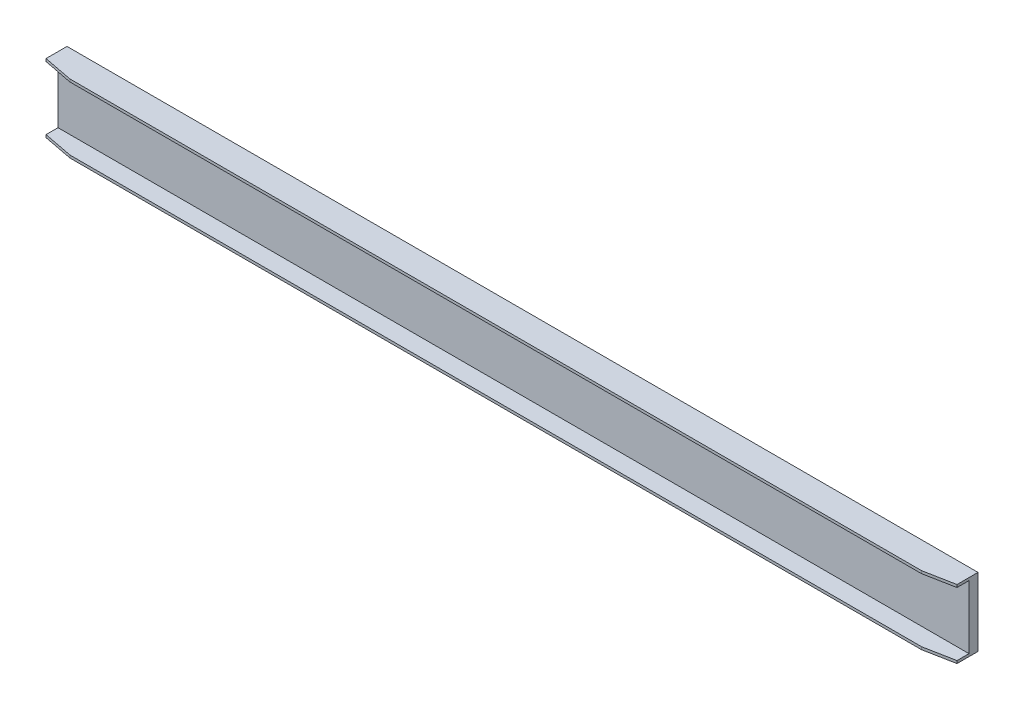
from build123d import *

# Parameters (mm, degrees)
SKETCH_1_W          = 3990
SKETCH_1_H          = 300
SKETCH_1_R          = 13
SKETCH_1_R_2        = 11.5
EXTRUDE_1608_DEPTH  = 39.5
SKETCH_2_W          = 3990
SKETCH_2_H          = 11.5
EXTRUDE_1_DEPTH     = 77.5
SKETCH_3_W          = 70
SKETCH_3_H          = 230
EXTRUDE_2_DEPTH     = 16
SKETCH_4_R          = 13
CUT_EXTRUDE_1_DEPTH = 2003.131676489
CUT_EXTRUDE_2_DEPTH = 2021.820130541
SKETCH_6_W          = 3990
SKETCH_6_H          = 277
EXTRUDE_3_DEPTH     = 39.5
SKETCH_7_W          = 70
SKETCH_7_H          = 230
EXTRUDE_4_DEPTH     = 16


with BuildPart() as part:
    # 草图1 → Extrude 1608 (new body)
    with BuildSketch(Plane.XY):
        Rectangle(SKETCH_1_W, SKETCH_1_H)
        with Locations((1940, 80)):
            Circle(SKETCH_1_R, mode=Mode.SUBTRACT)
        with Locations((1860, 80)):
            Circle(SKETCH_1_R, mode=Mode.SUBTRACT)
        with Locations((1780, 80)):
            Circle(SKETCH_1_R, mode=Mode.SUBTRACT)
        with Locations((1700, 80)):
            Circle(SKETCH_1_R, mode=Mode.SUBTRACT)
        with Locations((1540, 80)):
            Circle(SKETCH_1_R_2, mode=Mode.SUBTRACT)
        with Locations((1380, 80)):
            Circle(SKETCH_1_R_2, mode=Mode.SUBTRACT)
        with Locations((1220, 80)):
            Circle(SKETCH_1_R_2, mode=Mode.SUBTRACT)
        with Locations((1060, 80)):
            Circle(SKETCH_1_R_2, mode=Mode.SUBTRACT)
        with Locations((980, 80)):
            Circle(SKETCH_1_R_2, mode=Mode.SUBTRACT)
        with Locations((820, 80)):
            Circle(SKETCH_1_R_2, mode=Mode.SUBTRACT)
        with Locations((740, 80)):
            Circle(SKETCH_1_R_2, mode=Mode.SUBTRACT)
        with Locations((580, 80)):
            Circle(SKETCH_1_R_2, mode=Mode.SUBTRACT)
        with Locations((980, 0)):
            Circle(SKETCH_1_R_2, mode=Mode.SUBTRACT)
        with Locations((1060, 0)):
            Circle(SKETCH_1_R_2, mode=Mode.SUBTRACT)
        with Locations((820, 0)):
            Circle(SKETCH_1_R_2, mode=Mode.SUBTRACT)
        with Locations((740, 0)):
            Circle(SKETCH_1_R_2, mode=Mode.SUBTRACT)
        with Locations((580, 0)):
            Circle(SKETCH_1_R_2, mode=Mode.SUBTRACT)
        with Locations((1220, 0)):
            Circle(SKETCH_1_R_2, mode=Mode.SUBTRACT)
        with Locations((1380, 0)):
            Circle(SKETCH_1_R_2, mode=Mode.SUBTRACT)
        with Locations((1540, 0)):
            Circle(SKETCH_1_R_2, mode=Mode.SUBTRACT)
        with Locations((1700, 0)):
            Circle(SKETCH_1_R, mode=Mode.SUBTRACT)
        with Locations((1780, 0)):
            Circle(SKETCH_1_R, mode=Mode.SUBTRACT)
        with Locations((1860, 0)):
            Circle(SKETCH_1_R, mode=Mode.SUBTRACT)
        with Locations((1940, 0)):
            Circle(SKETCH_1_R, mode=Mode.SUBTRACT)
        with Locations((420, 80)):
            Circle(SKETCH_1_R_2, mode=Mode.SUBTRACT)
        with Locations((420, 0)):
            Circle(SKETCH_1_R_2, mode=Mode.SUBTRACT)
        with Locations((300, 0)):
            Circle(SKETCH_1_R_2, mode=Mode.SUBTRACT)
        with Locations((300, 80)):
            Circle(SKETCH_1_R_2, mode=Mode.SUBTRACT)
        with Locations((220, 80)):
            Circle(SKETCH_1_R_2, mode=Mode.SUBTRACT)
        with Locations((220, 0)):
            Circle(SKETCH_1_R_2, mode=Mode.SUBTRACT)
        with Locations((140, 0)):
            Circle(SKETCH_1_R, mode=Mode.SUBTRACT)
        with Locations((140, 80)):
            Circle(SKETCH_1_R, mode=Mode.SUBTRACT)
        with Locations((60, 80)):
            Circle(SKETCH_1_R, mode=Mode.SUBTRACT)
        with Locations((60, 0)):
            Circle(SKETCH_1_R, mode=Mode.SUBTRACT)
        with Locations(Location((1700, -80, 0), (0, 0, 180))):
            Circle(SKETCH_1_R, mode=Mode.SUBTRACT)
        with Locations(Location((1780, -80, 0), (0, 0, 180))):
            Circle(SKETCH_1_R, mode=Mode.SUBTRACT)
        with Locations(Location((1860, -80, 0), (0, 0, 180))):
            Circle(SKETCH_1_R, mode=Mode.SUBTRACT)
        with Locations(Location((1940, -80, 0), (0, 0, 180))):
            Circle(SKETCH_1_R, mode=Mode.SUBTRACT)
        with Locations(Location((580, -80, 0), (0, 0, 180))):
            Circle(SKETCH_1_R_2, mode=Mode.SUBTRACT)
        with Locations(Location((740, -80, 0), (0, 0, 180))):
            Circle(SKETCH_1_R_2, mode=Mode.SUBTRACT)
        with Locations(Location((820, -80, 0), (0, 0, 180))):
            Circle(SKETCH_1_R_2, mode=Mode.SUBTRACT)
        with Locations(Location((980, -80, 0), (0, 0, 180))):
            Circle(SKETCH_1_R_2, mode=Mode.SUBTRACT)
        with Locations(Location((1060, -80, 0), (0, 0, 180))):
            Circle(SKETCH_1_R_2, mode=Mode.SUBTRACT)
        with Locations(Location((1220, -80, 0), (0, 0, 180))):
            Circle(SKETCH_1_R_2, mode=Mode.SUBTRACT)
        with Locations(Location((1380, -80, 0), (0, 0, 180))):
            Circle(SKETCH_1_R_2, mode=Mode.SUBTRACT)
        with Locations(Location((1540, -80, 0), (0, 0, 180))):
            Circle(SKETCH_1_R_2, mode=Mode.SUBTRACT)
        with Locations(Location((220, -80, 0), (0, 0, 180))):
            Circle(SKETCH_1_R_2, mode=Mode.SUBTRACT)
        with Locations(Location((300, -80, 0), (0, 0, 180))):
            Circle(SKETCH_1_R_2, mode=Mode.SUBTRACT)
        with Locations(Location((420, -80, 0), (0, 0, 180))):
            Circle(SKETCH_1_R_2, mode=Mode.SUBTRACT)
        with Locations(Location((60, -80, 0), (0, 0, 180))):
            Circle(SKETCH_1_R, mode=Mode.SUBTRACT)
        with Locations(Location((140, -80, 0), (0, 0, 180))):
            Circle(SKETCH_1_R, mode=Mode.SUBTRACT)
        with Locations((-140, -80)):
            Circle(SKETCH_1_R, mode=Mode.SUBTRACT)
        with Locations((-60, -80)):
            Circle(SKETCH_1_R, mode=Mode.SUBTRACT)
        with Locations((-580, -80)):
            Circle(SKETCH_1_R_2, mode=Mode.SUBTRACT)
        with Locations((-420, -80)):
            Circle(SKETCH_1_R_2, mode=Mode.SUBTRACT)
        with Locations((-300, -80)):
            Circle(SKETCH_1_R_2, mode=Mode.SUBTRACT)
        with Locations((-220, -80)):
            Circle(SKETCH_1_R_2, mode=Mode.SUBTRACT)
        with Locations((-1540, -80)):
            Circle(SKETCH_1_R_2, mode=Mode.SUBTRACT)
        with Locations((-1380, -80)):
            Circle(SKETCH_1_R_2, mode=Mode.SUBTRACT)
        with Locations((-1220, -80)):
            Circle(SKETCH_1_R_2, mode=Mode.SUBTRACT)
        with Locations((-1060, -80)):
            Circle(SKETCH_1_R_2, mode=Mode.SUBTRACT)
        with Locations((-980, -80)):
            Circle(SKETCH_1_R_2, mode=Mode.SUBTRACT)
        with Locations((-820, -80)):
            Circle(SKETCH_1_R_2, mode=Mode.SUBTRACT)
        with Locations((-740, -80)):
            Circle(SKETCH_1_R_2, mode=Mode.SUBTRACT)
        with Locations((-1940, -80)):
            Circle(SKETCH_1_R, mode=Mode.SUBTRACT)
        with Locations((-1860, -80)):
            Circle(SKETCH_1_R, mode=Mode.SUBTRACT)
        with Locations((-1780, -80)):
            Circle(SKETCH_1_R, mode=Mode.SUBTRACT)
        with Locations((-1700, -80)):
            Circle(SKETCH_1_R, mode=Mode.SUBTRACT)
        with Locations(Location((-60, 0, 0), (0, 0, 180))):
            Circle(SKETCH_1_R, mode=Mode.SUBTRACT)
        with Locations(Location((-60, 80, 0), (0, 0, 180))):
            Circle(SKETCH_1_R, mode=Mode.SUBTRACT)
        with Locations(Location((-140, 80, 0), (0, 0, 180))):
            Circle(SKETCH_1_R, mode=Mode.SUBTRACT)
        with Locations(Location((-140, 0, 0), (0, 0, 180))):
            Circle(SKETCH_1_R, mode=Mode.SUBTRACT)
        with Locations(Location((-220, 0, 0), (0, 0, 180))):
            Circle(SKETCH_1_R_2, mode=Mode.SUBTRACT)
        with Locations(Location((-220, 80, 0), (0, 0, 180))):
            Circle(SKETCH_1_R_2, mode=Mode.SUBTRACT)
        with Locations(Location((-300, 80, 0), (0, 0, 180))):
            Circle(SKETCH_1_R_2, mode=Mode.SUBTRACT)
        with Locations(Location((-300, 0, 0), (0, 0, 180))):
            Circle(SKETCH_1_R_2, mode=Mode.SUBTRACT)
        with Locations(Location((-420, 0, 0), (0, 0, 180))):
            Circle(SKETCH_1_R_2, mode=Mode.SUBTRACT)
        with Locations(Location((-420, 80, 0), (0, 0, 180))):
            Circle(SKETCH_1_R_2, mode=Mode.SUBTRACT)
        with Locations(Location((-1940, 0, 0), (0, 0, 180))):
            Circle(SKETCH_1_R, mode=Mode.SUBTRACT)
        with Locations(Location((-1860, 0, 0), (0, 0, 180))):
            Circle(SKETCH_1_R, mode=Mode.SUBTRACT)
        with Locations(Location((-1780, 0, 0), (0, 0, 180))):
            Circle(SKETCH_1_R, mode=Mode.SUBTRACT)
        with Locations(Location((-1700, 0, 0), (0, 0, 180))):
            Circle(SKETCH_1_R, mode=Mode.SUBTRACT)
        with Locations(Location((-1540, 0, 0), (0, 0, 180))):
            Circle(SKETCH_1_R_2, mode=Mode.SUBTRACT)
        with Locations(Location((-1380, 0, 0), (0, 0, 180))):
            Circle(SKETCH_1_R_2, mode=Mode.SUBTRACT)
        with Locations(Location((-1220, 0, 0), (0, 0, 180))):
            Circle(SKETCH_1_R_2, mode=Mode.SUBTRACT)
        with Locations(Location((-580, 0, 0), (0, 0, 180))):
            Circle(SKETCH_1_R_2, mode=Mode.SUBTRACT)
        with Locations(Location((-740, 0, 0), (0, 0, 180))):
            Circle(SKETCH_1_R_2, mode=Mode.SUBTRACT)
        with Locations(Location((-820, 0, 0), (0, 0, 180))):
            Circle(SKETCH_1_R_2, mode=Mode.SUBTRACT)
        with Locations(Location((-1060, 0, 0), (0, 0, 180))):
            Circle(SKETCH_1_R_2, mode=Mode.SUBTRACT)
        with Locations(Location((-980, 0, 0), (0, 0, 180))):
            Circle(SKETCH_1_R_2, mode=Mode.SUBTRACT)
        with Locations(Location((-580, 80, 0), (0, 0, 180))):
            Circle(SKETCH_1_R_2, mode=Mode.SUBTRACT)
        with Locations(Location((-740, 80, 0), (0, 0, 180))):
            Circle(SKETCH_1_R_2, mode=Mode.SUBTRACT)
        with Locations(Location((-820, 80, 0), (0, 0, 180))):
            Circle(SKETCH_1_R_2, mode=Mode.SUBTRACT)
        with Locations(Location((-980, 80, 0), (0, 0, 180))):
            Circle(SKETCH_1_R_2, mode=Mode.SUBTRACT)
        with Locations(Location((-1060, 80, 0), (0, 0, 180))):
            Circle(SKETCH_1_R_2, mode=Mode.SUBTRACT)
        with Locations(Location((-1220, 80, 0), (0, 0, 180))):
            Circle(SKETCH_1_R_2, mode=Mode.SUBTRACT)
        with Locations(Location((-1380, 80, 0), (0, 0, 180))):
            Circle(SKETCH_1_R_2, mode=Mode.SUBTRACT)
        with Locations(Location((-1540, 80, 0), (0, 0, 180))):
            Circle(SKETCH_1_R_2, mode=Mode.SUBTRACT)
        with Locations(Location((-1700, 80, 0), (0, 0, 180))):
            Circle(SKETCH_1_R, mode=Mode.SUBTRACT)
        with Locations(Location((-1780, 80, 0), (0, 0, 180))):
            Circle(SKETCH_1_R, mode=Mode.SUBTRACT)
        with Locations(Location((-1860, 80, 0), (0, 0, 180))):
            Circle(SKETCH_1_R, mode=Mode.SUBTRACT)
        with Locations(Location((-1940, 80, 0), (0, 0, 180))):
            Circle(SKETCH_1_R, mode=Mode.SUBTRACT)
    extrude(amount=EXTRUDE_1608_DEPTH)

    # 草图2 → 凸台-拉伸1 (add)
    with BuildSketch(Plane.XY.offset(39.5)):
        with Locations((0, 144.25)):
            Rectangle(SKETCH_2_W, SKETCH_2_H)
        with Locations((0, -144.25)):
            Rectangle(SKETCH_2_W, SKETCH_2_H)
    extrude(amount=EXTRUDE_1_DEPTH)

    # 草图3 → 凸台-拉伸2 (add)
    with BuildSketch(Plane(origin=(0, 0, 0), x_dir=(-1, 0, 0), z_dir=(0, 0, -1))):
        with Locations((1300, 0)):
            Rectangle(SKETCH_3_W, SKETCH_3_H)
        with Locations((900, 0)):
            Rectangle(SKETCH_3_W, SKETCH_3_H)
        with Locations((-1300, 0)):
            Rectangle(SKETCH_3_W, SKETCH_3_H)
        with Locations((500, 0)):
            Rectangle(SKETCH_3_W, SKETCH_3_H)
        with Locations((-900, 0)):
            Rectangle(SKETCH_3_W, SKETCH_3_H)
        with Locations((-500, 0)):
            Rectangle(SKETCH_3_W, SKETCH_3_H)
    extrude(amount=EXTRUDE_2_DEPTH)

    # 草图4 → 切除-拉伸1 (cut, through all)
    with BuildSketch(Plane.XY.offset(39.5)):
        with Locations((1300, 80)):
            Circle(SKETCH_4_R)
        with Locations((900, 80)):
            Circle(SKETCH_4_R)
        with Locations((900, 0)):
            Circle(SKETCH_4_R)
        with Locations((1300, 0)):
            Circle(SKETCH_4_R)
        with Locations(Location((900, -80, 0), (0, 0, 180))):
            Circle(SKETCH_4_R)
        with Locations(Location((1300, -80, 0), (0, 0, 180))):
            Circle(SKETCH_4_R)
        with Locations((500, 80)):
            Circle(SKETCH_4_R)
        with Locations((500, 0)):
            Circle(SKETCH_4_R)
        with Locations(Location((500, -80, 0), (0, 0, 180))):
            Circle(SKETCH_4_R)
        with Locations((-500, -80)):
            Circle(SKETCH_4_R)
        with Locations(Location((-500, 0, 0), (0, 0, 180))):
            Circle(SKETCH_4_R)
        with Locations(Location((-500, 80, 0), (0, 0, 180))):
            Circle(SKETCH_4_R)
        with Locations((-1300, -80)):
            Circle(SKETCH_4_R)
        with Locations((-900, -80)):
            Circle(SKETCH_4_R)
        with Locations(Location((-1300, 0, 0), (0, 0, 180))):
            Circle(SKETCH_4_R)
        with Locations(Location((-900, 0, 0), (0, 0, 180))):
            Circle(SKETCH_4_R)
        with Locations(Location((-900, 80, 0), (0, 0, 180))):
            Circle(SKETCH_4_R)
        with Locations(Location((-1300, 80, 0), (0, 0, 180))):
            Circle(SKETCH_4_R)
    extrude(amount=-CUT_EXTRUDE_1_DEPTH, mode=Mode.SUBTRACT)

    # 草图5 → 切除-拉伸2 (cut, through all)
    with BuildSketch(Plane(origin=(0, 150, 0), x_dir=(-1, 0, 0), z_dir=(0, 1, 0))):
        Polygon((-1995, 92), (-1995, 117), (-1865, 117), align=None)
        Polygon((1865, 117), (1995, 92), (1995, 117), align=None)
    extrude(amount=-CUT_EXTRUDE_2_DEPTH, mode=Mode.SUBTRACT)

    # 草图6 → 凸台-拉伸3 (add)
    with BuildSketch(Plane.XY.offset(39.5)):
        Rectangle(SKETCH_6_W, SKETCH_6_H)
    extrude(amount=-EXTRUDE_3_DEPTH)

    # 草图7 → 凸台-拉伸4 (add)
    with BuildSketch(Plane(origin=(0, 0, 0), x_dir=(-1, 0, 0), z_dir=(0, 0, -1))):
        with Locations((-1300, 0)):
            Rectangle(SKETCH_7_W, SKETCH_7_H)
        with Locations((-900, 0)):
            Rectangle(SKETCH_7_W, SKETCH_7_H)
        with Locations((-500, 0)):
            Rectangle(SKETCH_7_W, SKETCH_7_H)
        with Locations((500, 0)):
            Rectangle(SKETCH_7_W, SKETCH_7_H)
        with Locations((900, 0)):
            Rectangle(SKETCH_7_W, SKETCH_7_H)
        with Locations((1300, 0)):
            Rectangle(SKETCH_7_W, SKETCH_7_H)
    extrude(amount=EXTRUDE_4_DEPTH)


solid = part.part
